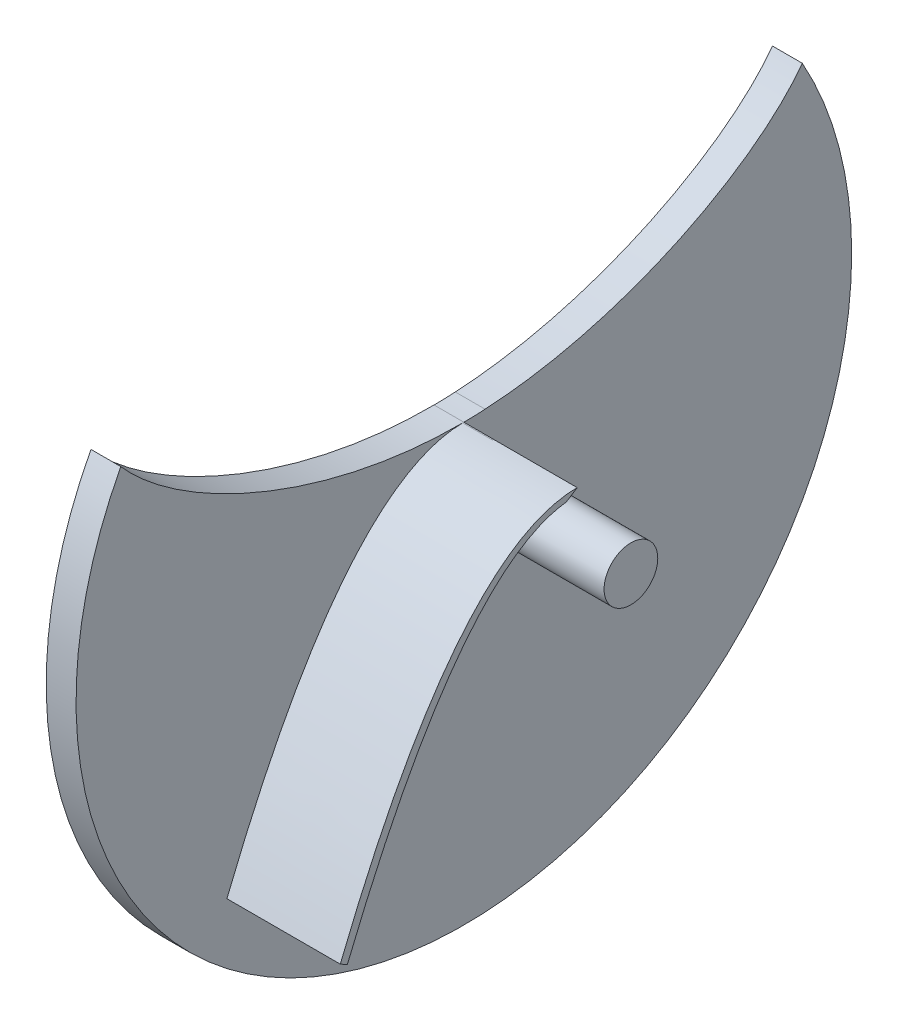
from build123d import *

# Parameters (mm, degrees)
SKETCH1_R           = 65
BOSS_EXTRUDE1_DEPTH = 5
SKETCH2_R           = 57
CUT_EXTRUDE1_DEPTH  = 5
SKETCH3_R           = 4.5
BOSS_EXTRUDE2_DEPTH = 28
BOSS_EXTRUDE3_DEPTH = 19
CUT_EXTRUDE2_DEPTH  = 10


with BuildPart() as part:
    # Sketch1 → Boss-Extrude1 (new body)
    with BuildSketch(Plane(origin=(0, 0, 0), x_dir=(0, 0, -1), z_dir=(1, 0, 0))):
        Circle(SKETCH1_R)
    extrude(amount=BOSS_EXTRUDE1_DEPTH)

    # Sketch2 → Cut-Extrude1 (cut)
    with BuildSketch(Plane(origin=(5, 0, 0), x_dir=(0, 0, -1), z_dir=(1, 0, 0))):
        with Locations((0, 65)):
            Circle(SKETCH2_R)
    extrude(amount=-CUT_EXTRUDE1_DEPTH, mode=Mode.SUBTRACT)

    # Sketch3 → Boss-Extrude2 (add)
    with BuildSketch(Plane(origin=(5, 0, 0), x_dir=(0, 0, -1), z_dir=(1, 0, 0))):
        Circle(SKETCH3_R)
    extrude(amount=BOSS_EXTRUDE2_DEPTH)

    # Sketch4 → Boss-Extrude3 (add)
    with BuildSketch(Plane(origin=(5, 0, 0), x_dir=(0, 0, -1), z_dir=(1, 0, 0))):
        with BuildLine():
            Line((-38.528819584, -41.954177593), (-39.717618419, -41.296537903))
            add(Edge.make_bspline(
                [(-39.717618419, -41.296537903), (-19.85880921, 8), (0, 8)],
                knots=[0, 0, 0, 1, 1, 1], degree=2))
            Line((0, 8), (-1.834255985, 6.832495808))
            add(Edge.make_bspline(
                [(-38.528819584, -41.954177593), (-19.49735867, 4.777398316), (-1.834255985, 6.832495808)],
                knots=[0, 0, 0, 1, 1, 1], degree=2))
        make_face()
    extrude(amount=BOSS_EXTRUDE3_DEPTH)

    # Sketch5 → Cut-Extrude2 (cut)
    with BuildSketch(Plane.ZY):
        with BuildLine():
            add(Edge.make_bspline(
                [(-59.611313459, 41.161832135), (-62.271021167, 28.272133344), (0.725304908, -12.45080433), (121.126777355, 64.589791019), (-54.876290799, 64.109096486), (-59.611313459, 41.161832135)],
                knots=[0, 0, 0, 0, 0.262262558, 0.533099388, 1, 1, 1, 1], degree=3))
        make_face()
    extrude(amount=-CUT_EXTRUDE2_DEPTH, mode=Mode.SUBTRACT)


solid = part.part
